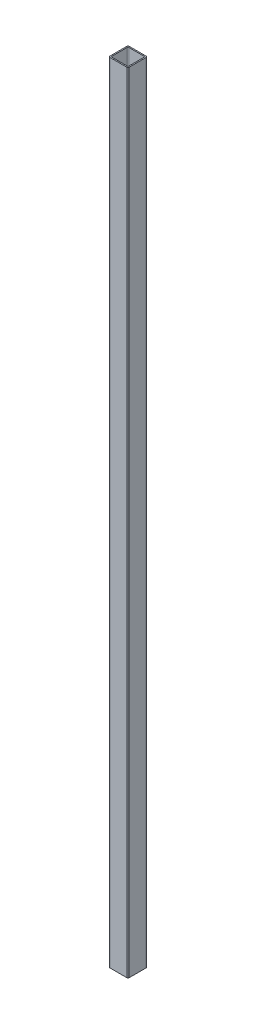
from build123d import *

# Parameters (mm, degrees)
EXTRUDE_1_DEPTH = 2045


with BuildPart() as part:
    # Эскиз1 → Бобышка-Вытянуть1 (new body)
    with BuildSketch(Plane(origin=(0, 0, 0), x_dir=(1, 0, 0), z_dir=(0, 1, 0))):
        with BuildLine():
            Line((3, 25), (47, 25))
            ThreePointArc((47, 25), (49.121320344, 24.121320344), (50, 22))
            Line((50, 22), (50, -22))
            ThreePointArc((50, -22), (49.121320344, -24.121320344), (47, -25))
            Line((47, -25), (3, -25))
            ThreePointArc((3, -25), (0.878679656, -24.121320344), (0, -22))
            Line((0, -22), (0, 22))
            ThreePointArc((0, 22), (0.878679656, 24.121320344), (3, 25))
        make_face()
        with BuildLine():
            Line((5, 22), (45, 22))
            ThreePointArc((45, 22), (46.414213562, 21.414213562), (47, 20))
            Line((47, 20), (47, -20))
            ThreePointArc((47, -20), (46.414213562, -21.414213562), (45, -22))
            Line((45, -22), (5, -22))
            ThreePointArc((5, -22), (3.585786438, -21.414213562), (3, -20))
            Line((3, -20), (3, 20))
            ThreePointArc((3, 20), (3.585786438, 21.414213562), (5, 22))
        make_face(mode=Mode.SUBTRACT)
    extrude(amount=EXTRUDE_1_DEPTH)


solid = part.part
